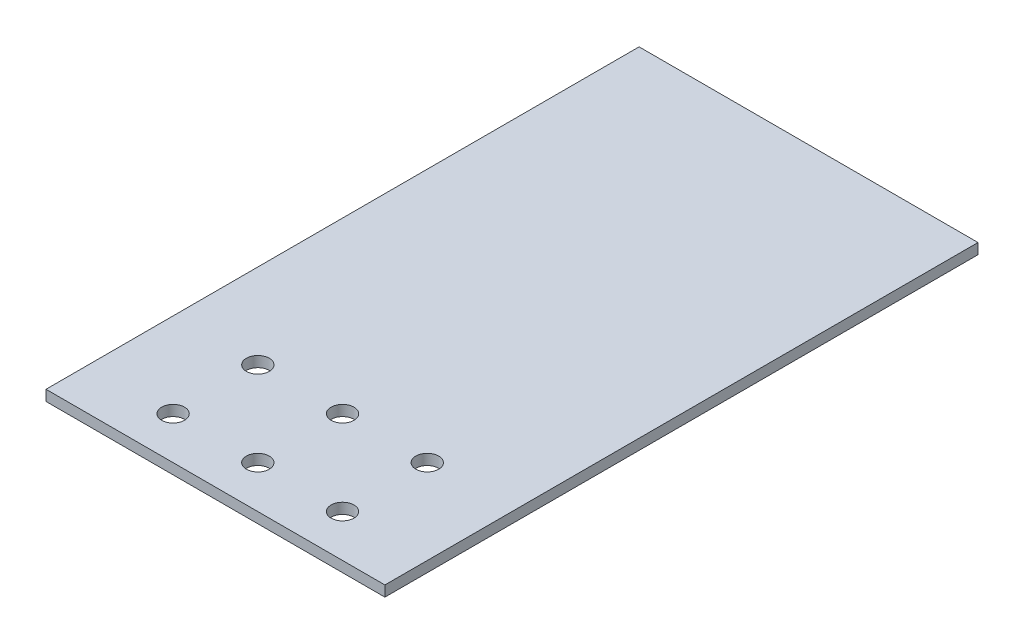
from build123d import *

# Parameters (mm, degrees)
SKETCH1_W           = 101.6
SKETCH1_H           = 177.8
SKETCH1_R           = 3.429
BOSS_EXTRUDE1_DEPTH = 3.175


with BuildPart() as part:
    # Sketch1 → Boss-Extrude1 (new body)
    with BuildSketch(Plane(origin=(0, 0, 0), x_dir=(1, 0, 0), z_dir=(0, 1, 0))):
        Rectangle(SKETCH1_W, SKETCH1_H)
        with Locations(Location((-25.4, -76.2, 0), (0, 0, 270))):
            Circle(SKETCH1_R, mode=Mode.SUBTRACT)
        with Locations(Location((0, -76.2, 0), (0, 0, 270))):
            Circle(SKETCH1_R, mode=Mode.SUBTRACT)
        with Locations(Location((25.4, -76.2, 0), (0, 0, 270))):
            Circle(SKETCH1_R, mode=Mode.SUBTRACT)
        with Locations(Location((0, -50.8, 0), (0, 0, 270))):
            Circle(SKETCH1_R, mode=Mode.SUBTRACT)
        with Locations(Location((25.4, -50.8, 0), (0, 0, 270))):
            Circle(SKETCH1_R, mode=Mode.SUBTRACT)
        with Locations(Location((-25.4, -50.8, 0), (0, 0, 270))):
            Circle(SKETCH1_R, mode=Mode.SUBTRACT)
    extrude(amount=BOSS_EXTRUDE1_DEPTH)


solid = part.part
